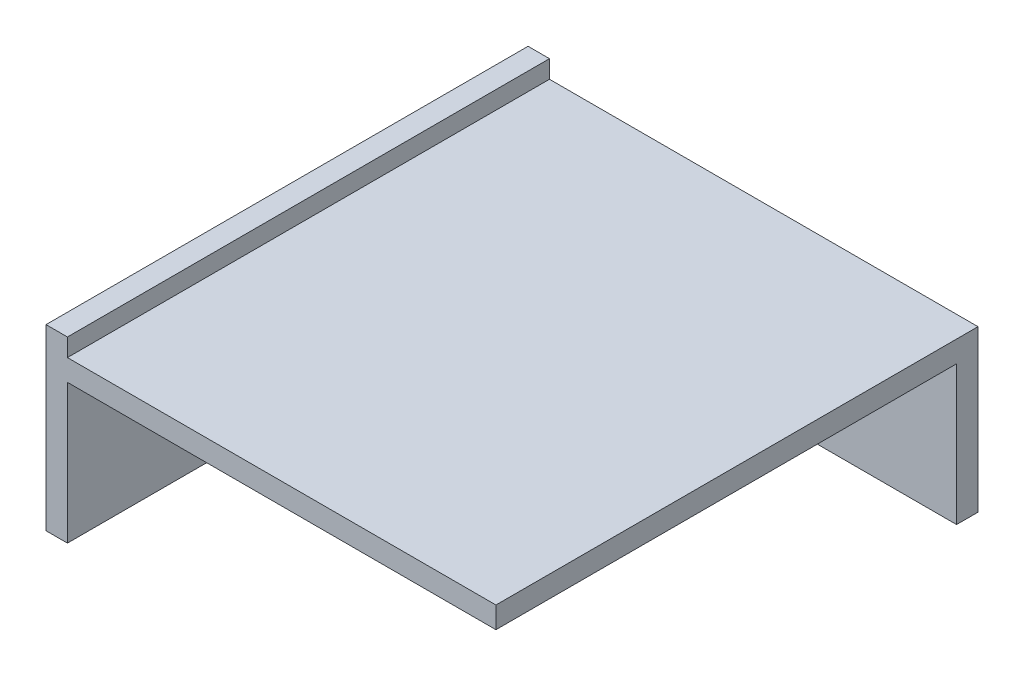
from build123d import *

# Parameters (mm, degrees)
SKETCH_1_W      = 240
SKETCH_1_H      = 270
EXTRUDE_1_DEPTH = 12
SKETCH_2_W      = 270
SKETCH_2_H      = 100
EXTRUDE_2_DEPTH = 12
SKETCH_3_W      = 12
SKETCH_3_H      = 78
EXTRUDE_3_DEPTH = 240


with BuildPart() as part:
    # 草图1 → 凸台-拉伸1 (new body)
    with BuildSketch(Plane(origin=(0, 0, 0), x_dir=(1, 0, 0), z_dir=(0, 1, 0))):
        with Locations((120, 135)):
            Rectangle(SKETCH_1_W, SKETCH_1_H)
    extrude(amount=EXTRUDE_1_DEPTH)

    # 草图2 → 凸台-拉伸2 (add)
    with BuildSketch(Plane.ZY):
        with Locations((-135, -28)):
            Rectangle(SKETCH_2_W, SKETCH_2_H)
    extrude(amount=EXTRUDE_2_DEPTH)

    # 草图3 → 凸台-拉伸3 (add)
    with BuildSketch(Plane(origin=(0, 0, 0), x_dir=(0, 0, -1), z_dir=(1, 0, 0))):
        with Locations((264, -39)):
            Rectangle(SKETCH_3_W, SKETCH_3_H)
    extrude(amount=EXTRUDE_3_DEPTH)


solid = part.part
